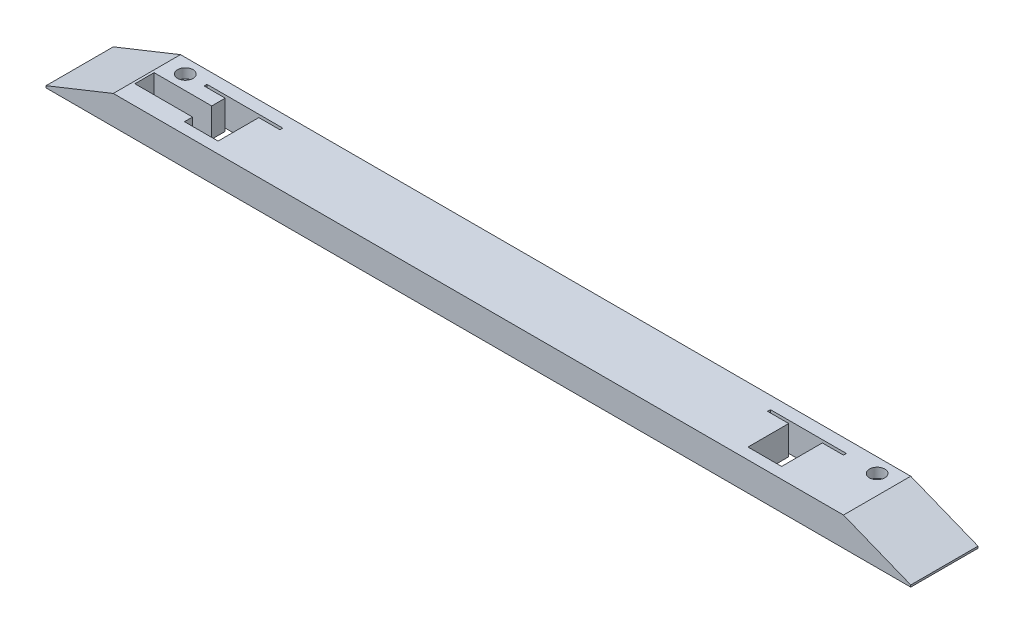
from build123d import *

# Parameters (mm, degrees)
BOSS_EXTRUDE1_DEPTH             = 35
CUT_EXTRUDE1_DEPTH              = 452.608237303
CUT_EXTRUDE2_DEPTH              = 452.608237303
M8X1_0_TAPPED_HOLE1_D           = 5
M8X1_0_TAPPED_HOLE1_CBORE_D     = 8
M8X1_0_TAPPED_HOLE1_CBORE_DEPTH = 5


with BuildPart() as part:
    # Sketch1 → Boss-Extrude1 (new body)
    with BuildSketch(Plane.XY.offset(35)):
        Polygon((0, 0), (450, 0), (450, 1), (415, 15), (35, 15), (0, 1), align=None)
    extrude(amount=-BOSS_EXTRUDE1_DEPTH)

    # Sketch2 → Cut-Extrude1 (cut, through all)
    with BuildSketch(Plane(origin=(0, 15, 0), x_dir=(-1, 0, 0), z_dir=(0, 1, 0))):
        Polygon((-359.5, 8), (-359.5, 29.2), (-377, 29.2), (-377, 8), (-388, 8), (-388, 6.5), (-348.5, 6.5), (-348.5, 8), align=None)
    extrude(amount=-CUT_EXTRUDE1_DEPTH, mode=Mode.SUBTRACT)

    # Sketch3 → Cut-Extrude2 (cut, through all)
    with BuildSketch(Plane.XZ):
        Polygon((66.25, 15), (66.25, 8), (55.25, 8), (55.25, 6.5), (94.75, 6.5), (94.75, 8), (83.75, 8), (83.75, 29.2), (66.25, 29.2), (66.25, 25), (36.25, 25), (36.25, 15), align=None)
    extrude(amount=-CUT_EXTRUDE2_DEPTH, mode=Mode.SUBTRACT)

    # M8x1.0 Tapped Hole1 (through all)
    with Locations(Plane(origin=(0, 15, 0), x_dir=(1, 0, 0), z_dir=(0, 1, 0))):
        with Locations((45, -7.5), (405, -7.5)):
            CounterBoreHole(M8X1_0_TAPPED_HOLE1_D / 2, M8X1_0_TAPPED_HOLE1_CBORE_D / 2, M8X1_0_TAPPED_HOLE1_CBORE_DEPTH)


solid = part.part
